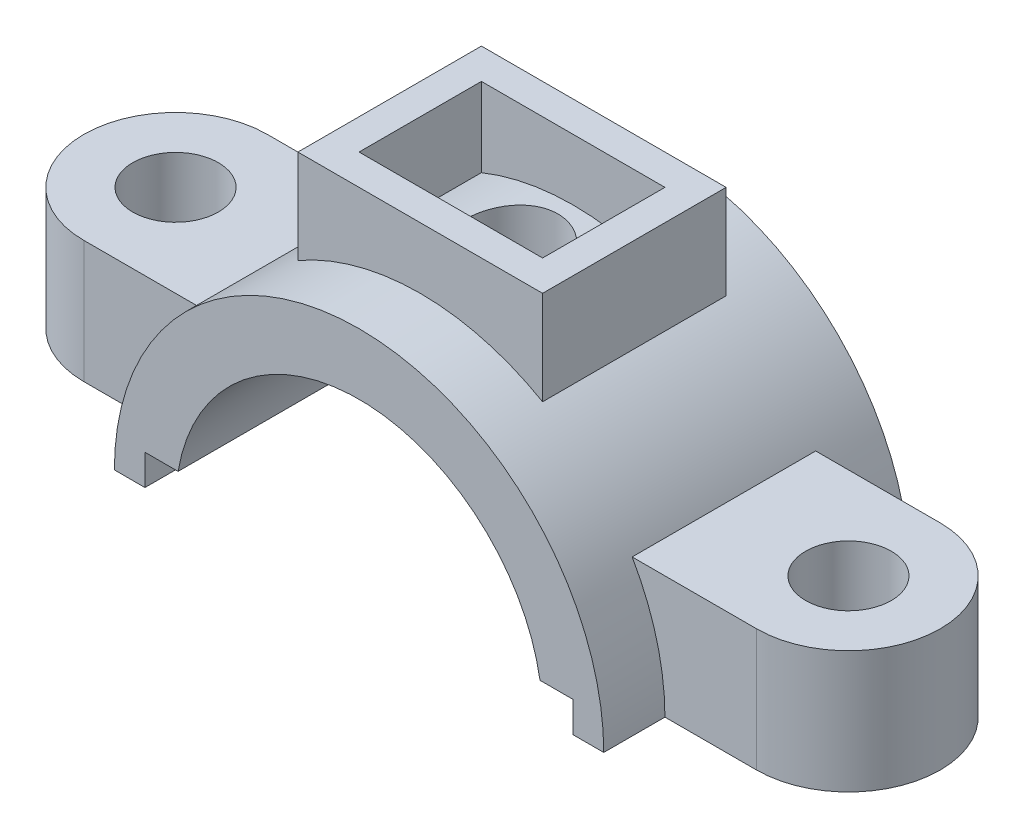
from build123d import *

# Parameters (mm, degrees)
SKETCH1_R                = 7
BOSS_EXTRUDE1_DEPTH      = 20
BOSS_EXTRUDE2_DEPTH      = 10
BOSS_EXTRUDE2_DEPTH_BACK = 40
CUT_EXTRUDE1_START       = -72
CUT_EXTRUDE1_DEPTH       = 72
BOSS_EXTRUDE5_START      = -40
BOSS_EXTRUDE5_DEPTH      = 40
CUT_EXTRUDE3_START       = -10
CUT_EXTRUDE3_DEPTH       = 10
CUT_EXTRUDE5_REACH       = 91.582
CUT_EXTRUDE5_END_RADIUS  = 40
SKETCH11_W               = 30
SKETCH11_H               = 20
SKETCH12_R               = 7.5
CUT_EXTRUDE6_DEPTH       = 70


with BuildPart() as part:
    # Sketch1 → Boss-Extrude1 (new body)
    with BuildSketch(Plane(origin=(0, 0, 0), x_dir=(1, 0, 0), z_dir=(0, 1, 0))):
        with BuildLine():
            Line((-55, 15), (55, 15))
            ThreePointArc((55, 15), (70, 0), (55, -15))
            Line((55, -15), (-55, -15))
            ThreePointArc((-55, -15), (-70, 0), (-55, 15))
        make_face()
        with Locations(Location((-55, 0, 0), (0, 0, 270))):
            Circle(SKETCH1_R, mode=Mode.SUBTRACT)
        with Locations(Location((55, 0, 0), (0, 0, 270))):
            Circle(SKETCH1_R, mode=Mode.SUBTRACT)
    extrude(amount=-BOSS_EXTRUDE1_DEPTH)

    # Sketch2 → Boss-Extrude2 (add, two sides: drawn at the far end of the back side and taken through both)
    with BuildSketch(Plane.XY.offset(15).offset(-BOSS_EXTRUDE2_DEPTH_BACK)):
        with BuildLine():
            Line((-40, -20), (-35, -20))
            Line((-35, -20), (-35, -15))
            Line((-35, -15), (-29.580398915, -15))
            ThreePointArc((-29.580398915, -15), (0, 10), (29.580398915, -15))
            Line((29.580398915, -15), (35, -15))
            Line((35, -15), (35, -20))
            Line((35, -20), (40, -20))
            ThreePointArc((40, -20), (0, 20), (-40, -20))
        make_face()
    extrude(amount=BOSS_EXTRUDE2_DEPTH + BOSS_EXTRUDE2_DEPTH_BACK)

    # Sketch3 → Cut-Extrude1 (cut)
    with BuildSketch(Plane.XY.offset(15).offset(CUT_EXTRUDE1_START)):
        with BuildLine():
            Line((-35, -20), (-35, -15))
            Line((-35, -15), (-29.580398915, -15))
            ThreePointArc((-29.580398915, -15), (0, 10), (29.580398915, -15))
            Line((29.580398915, -15), (35, -15))
            Line((35, -15), (35, -20))
            Line((35, -20), (-35, -20))
        make_face()
    extrude(amount=CUT_EXTRUDE1_DEPTH, mode=Mode.SUBTRACT)

    # Sketch7 → Boss-Extrude5 (add)
    with BuildSketch(Plane.XY.offset(25).offset(BOSS_EXTRUDE5_START)):
        with BuildLine():
            Line((-20, 30), (20, 30))
            Line((20, 30), (20, 14.641016151))
            ThreePointArc((20, 14.641016151), (0, 20), (-20, 14.641016151))
            Line((-20, 14.641016151), (-20, 30))
        make_face()
    extrude(amount=BOSS_EXTRUDE5_DEPTH)

    # Sketch10 → Cut-Extrude3 (cut)
    with BuildSketch(Plane.XY.offset(25).offset(CUT_EXTRUDE3_START)):
        with BuildLine():
            Line((-20, 14.641016151), (-20, 30))
            Line((-20, 30), (20, 30))
            Line((20, 30), (20, 14.641016151))
            ThreePointArc((20, 14.641016151), (0, 20), (-20, 14.641016151))
        make_face()
    extrude(amount=CUT_EXTRUDE3_DEPTH, mode=Mode.SUBTRACT)

    # Cut-Extrude5: up to this cylinder (the profile starts outside it)
    cut_extrude5_end = Plane(origin=(0, -20, 0), z_dir=(0, 0, 1)) * Cylinder(CUT_EXTRUDE5_END_RADIUS, 264.164, mode=Mode.PRIVATE)
    # Sketch11 → Cut-Extrude5 (cut, up to the surface)
    with BuildSketch(Plane(origin=(0, 30, 0), x_dir=(1, 0, 0), z_dir=(0, 1, 0)), mode=Mode.PRIVATE) as cut_extrude5_sk1:
        Rectangle(SKETCH11_W, SKETCH11_H)
    cut_extrude5_tool1 = extrude(cut_extrude5_sk1.sketch, amount=-CUT_EXTRUDE5_REACH, mode=Mode.PRIVATE) - cut_extrude5_end
    add(cut_extrude5_tool1.solids().sort_by_distance((0, 30, 0))[0], mode=Mode.SUBTRACT)

    # Sketch12 → Cut-Extrude6 (cut)
    with BuildSketch(Plane(origin=(0, 30, 0), x_dir=(1, 0, 0), z_dir=(0, 1, 0))):
        with Locations(Location((0, 0, 0), (0, 0, 270))):
            Circle(SKETCH12_R)
    extrude(amount=-CUT_EXTRUDE6_DEPTH, mode=Mode.SUBTRACT)


solid = part.part
